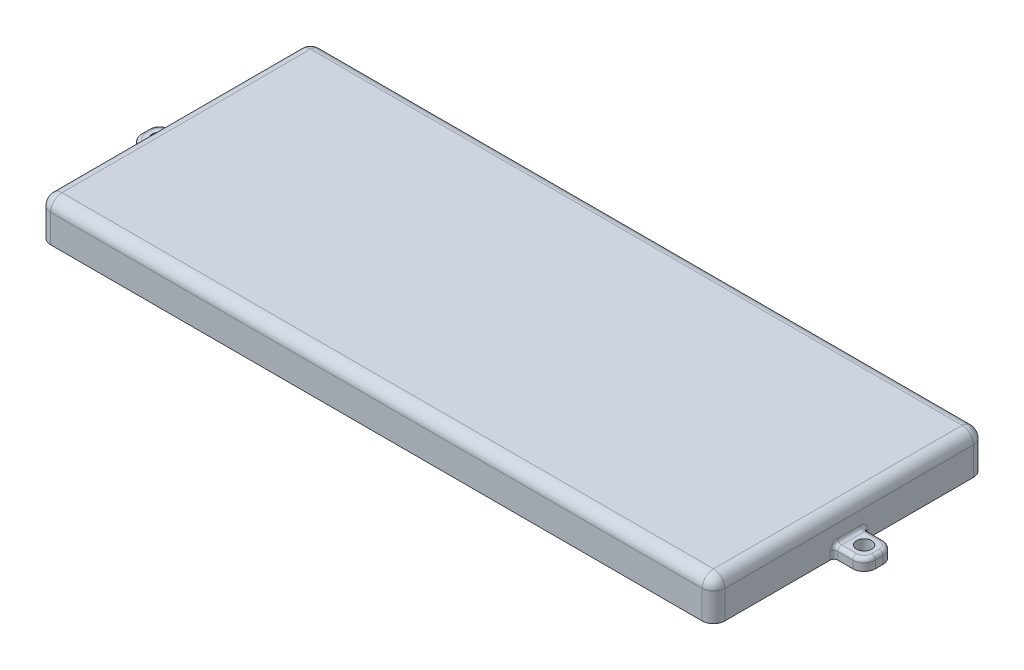
from build123d import *

# Parameters (mm, degrees)
SKETCH1_W           = 179
SKETCH1_H           = 72
BOSS_EXTRUDE1_DEPTH = 10.5
SHELL1_T            = -3
SKETCH2_W           = 8
SKETCH2_H           = 3
BOSS_EXTRUDE2_DEPTH = 8
SKETCH3_W           = 8
SKETCH3_H           = 3
BOSS_EXTRUDE3_DEPTH = 8
SKETCH4_R           = 2
CUT_EXTRUDE1_DEPTH  = 8
SKETCH5_R           = 2
CUT_EXTRUDE2_DEPTH  = 8
FILLET1_R           = 3
FILLET2_R           = 1


with BuildPart() as part:
    # Sketch1 → Boss-Extrude1 (new body)
    with BuildSketch(Plane(origin=(0, 0, 0), x_dir=(1, 0, 0), z_dir=(0, 1, 0))):
        Rectangle(SKETCH1_W, SKETCH1_H)
    extrude(amount=BOSS_EXTRUDE1_DEPTH)

    # Shell1
    shell1_openings = [part.faces().sort_by_distance(p)[0] for p in [
        (0, 0, 0),
    ]]
    offset(amount=SHELL1_T, openings=shell1_openings, kind=Kind.INTERSECTION)

    # Sketch2 → Boss-Extrude2 (add)
    with BuildSketch(Plane.ZY.offset(89.5)):
        with Locations((0, 1.5)):
            Rectangle(SKETCH2_W, SKETCH2_H)
    extrude(amount=BOSS_EXTRUDE2_DEPTH)

    # Sketch3 → Boss-Extrude3 (add)
    with BuildSketch(Plane(origin=(89.5, 0, 0), x_dir=(0, 0, -1), z_dir=(1, 0, 0))):
        with Locations((0, 1.5)):
            Rectangle(SKETCH3_W, SKETCH3_H)
    extrude(amount=BOSS_EXTRUDE3_DEPTH)

    # Sketch4 → Cut-Extrude1 (cut)
    with BuildSketch(Plane(origin=(0, 3, 0), x_dir=(1, 0, 0), z_dir=(0, 1, 0))):
        with Locations(Location((-93.5, 0, 0), (0, 0, 270))):
            Circle(SKETCH4_R)
    extrude(amount=-CUT_EXTRUDE1_DEPTH, mode=Mode.SUBTRACT)

    # Sketch5 → Cut-Extrude2 (cut)
    with BuildSketch(Plane(origin=(0, 3, 0), x_dir=(1, 0, 0), z_dir=(0, 1, 0))):
        with Locations(Location((93.5, 0, 0), (0, 0, 270))):
            Circle(SKETCH5_R)
    extrude(amount=-CUT_EXTRUDE2_DEPTH, mode=Mode.SUBTRACT)

    # Fillet1
    fillet1_edges = [part.edges().sort_by_distance(p)[0] for p in [
        (-89.5, 10.5, 0),
        (86.5, 3.75, 33),
        (86.5, 3.75, -33),
        (-86.5, 3.75, -33),
        (-86.5, 3.75, 33),
        (0, 10.5, 36),
        (-97.5, 1.5, -4),
        (-97.5, 1.5, 4),
        (97.5, 1.5, 4),
        (97.5, 1.5, -4),
        (89.5, 10.5, 0),
        (89.5, 5.25, 36),
        (-89.5, 5.25, 36),
        (-89.5, 5.25, -36),
        (89.5, 5.25, -36),
        (0, 10.5, -36),
    ]]
    fillet(fillet1_edges, radius=FILLET1_R)

    # Fillet2
    fillet2_edges = [part.edges().sort_by_distance(p)[0] for p in [
        (92, 3, -4),
        (96.621320344, 3, -3.121320344),
        (96.621320344, 3, 3.121320344),
        (-97.5, 3, 0),
        (-92, 3, -4),
        (-92, 3, 4),
        (-96.621320344, 3, 3.121320344),
        (-96.621320344, 3, -3.121320344),
        (-89.5, 1.5, -4),
        (-89.5, 1.5, 4),
        (-89.5, 3, 0),
        (89.5, 1.5, 4),
        (89.5, 1.5, -4),
        (89.5, 3, 0),
        (97.5, 3, 0),
        (92, 3, 4),
    ]]
    fillet(fillet2_edges, radius=FILLET2_R)


solid = part.part
